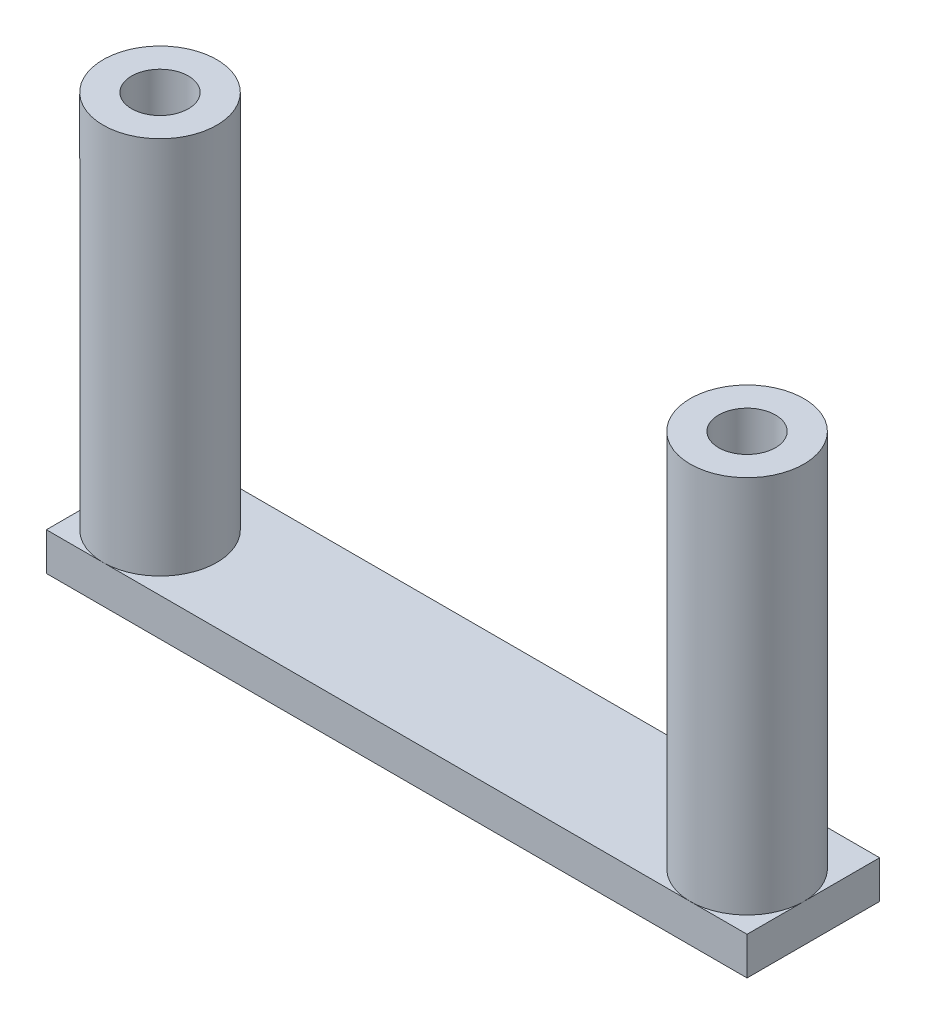
from build123d import *

# Parameters (mm, degrees)
SKETCH1_W           = 37
SKETCH1_H           = 31
SKETCH1_R           = 1.5
BOSS_EXTRUDE1_DEPTH = 2
SKETCH2_R           = 3
SKETCH2_R_2         = 1.5
BOSS_EXTRUDE2_DEPTH = 20
SKETCH3_W           = 37
SKETCH3_H           = 24
CUT_EXTRUDE1_DEPTH  = 50.2341345


with BuildPart() as part:
    # Sketch1 → Boss-Extrude1 (new body)
    with BuildSketch(Plane(origin=(0, 0, 0), x_dir=(1, 0, 0), z_dir=(0, 1, 0))):
        with Locations((15.5, 12.5)):
            Rectangle(SKETCH1_W, SKETCH1_H)
        with Locations(Location((0, 25, 0), (0, 0, 270))):
            Circle(SKETCH1_R, mode=Mode.SUBTRACT)
        with Locations(Location((31, 25, 0), (0, 0, 270))):
            Circle(SKETCH1_R, mode=Mode.SUBTRACT)
        with Locations(Location((31, 0, 0), (0, 0, 270))):
            Circle(SKETCH1_R, mode=Mode.SUBTRACT)
        with Locations(Location((0, 0, 0), (0, 0, 270))):
            Circle(SKETCH1_R, mode=Mode.SUBTRACT)
    extrude(amount=BOSS_EXTRUDE1_DEPTH)

    # Sketch2 → Boss-Extrude2 (add)
    # profile 1 of 4: a face of its own
    with BuildSketch(Plane(origin=(0, 2, 0), x_dir=(1, 0, 0), z_dir=(0, 1, 0))):
        with Locations(Location((0, 25, 0), (0, 0, 90))):
            Circle(SKETCH2_R)
        with Locations(Location((0, 25, 0), (0, 0, 270))):
            Circle(SKETCH2_R_2, mode=Mode.SUBTRACT)
    # profile 2 of 4: a face of its own
    with BuildSketch(Plane(origin=(0, 2, 0), x_dir=(1, 0, 0), z_dir=(0, 1, 0))):
        with Locations(Location((31, 25, 0), (0, 0, 90))):
            Circle(SKETCH2_R)
        with Locations(Location((31, 25, 0), (0, 0, 270))):
            Circle(SKETCH2_R_2, mode=Mode.SUBTRACT)
    # profile 3 of 4: a face of its own
    with BuildSketch(Plane(origin=(0, 2, 0), x_dir=(1, 0, 0), z_dir=(0, 1, 0))):
        with Locations(Location((31, 0, 0), (0, 0, 270))):
            Circle(SKETCH2_R)
        with Locations(Location((31, 0, 0), (0, 0, 270))):
            Circle(SKETCH2_R_2, mode=Mode.SUBTRACT)
    # profile 4 of 4: a face of its own
    with BuildSketch(Plane(origin=(0, 2, 0), x_dir=(1, 0, 0), z_dir=(0, 1, 0))):
        with Locations(Location((0, 0, 0), (0, 0, 270))):
            Circle(SKETCH2_R)
        with Locations(Location((0, 0, 0), (0, 0, 270))):
            Circle(SKETCH2_R_2, mode=Mode.SUBTRACT)
    extrude(amount=BOSS_EXTRUDE2_DEPTH)

    # Sketch3 → Cut-Extrude1 (cut, through all)
    with BuildSketch(Plane.XZ):
        with Locations((15.5, -16)):
            Rectangle(SKETCH3_W, SKETCH3_H)
    extrude(amount=-CUT_EXTRUDE1_DEPTH, mode=Mode.SUBTRACT)


solid = part.part
